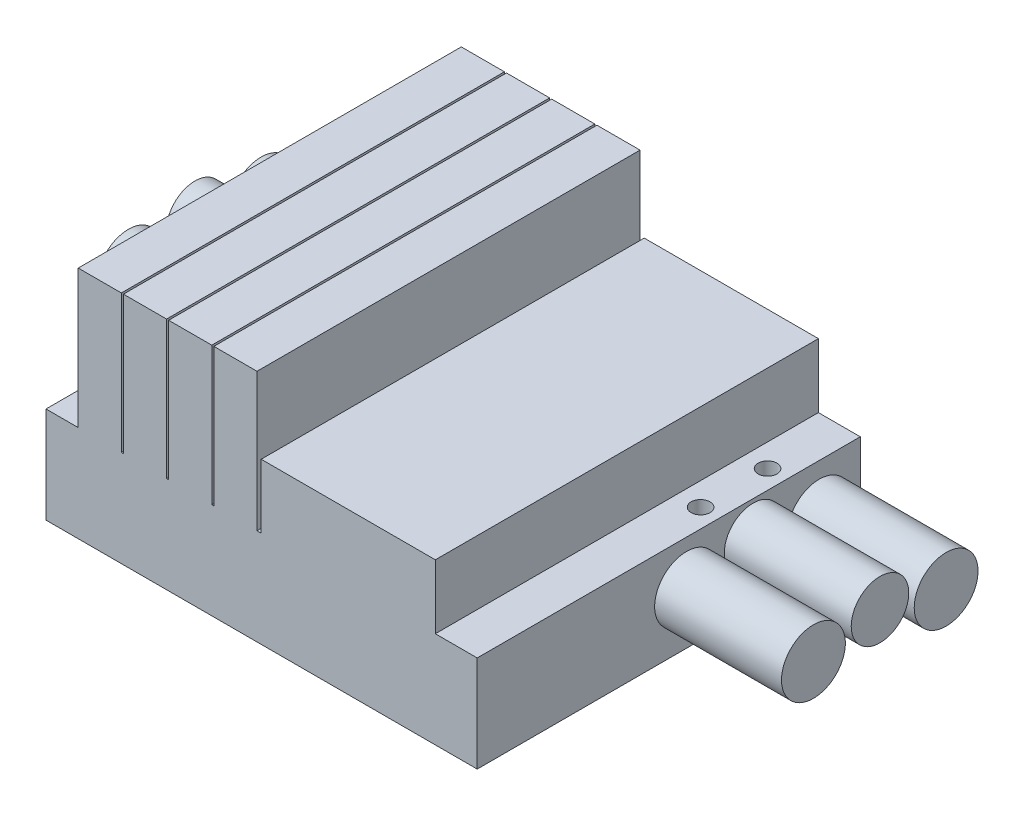
from build123d import *

# Parameters (mm, degrees)
SKETCH1_W           = 103
SKETCH1_H           = 91.5
SKETCH1_R           = 2.15
SKETCH1_R_2         = 2.25
BOSS_EXTRUDE1_DEPTH = 23
SKETCH2_R           = 7.625
SKETCH2_R_2         = 6.875
BOSS_EXTRUDE2_DEPTH = 30.31
SKETCH4_R           = 4.9
BOSS_EXTRUDE3_DEPTH = 14.15
BOSS_EXTRUDE4_START = -133.31
SKETCH2_7_R         = 7.625
SKETCH2_7_R_2       = 6.875
BOSS_EXTRUDE4_DEPTH = 30.31
SKETCH6_W           = 41.6
SKETCH6_H           = 91.5
BOSS_EXTRUDE5_DEPTH = 15.3
SKETCH6_5_W         = 10.3
SKETCH6_5_H         = 91.5
BOSS_EXTRUDE7_DEPTH = 33


with BuildPart() as part:
    # Sketch1 → Boss-Extrude1 (new body)
    with BuildSketch(Plane(origin=(0, 0, 0), x_dir=(1, 0, 0), z_dir=(0, 1, 0))):
        Rectangle(SKETCH1_W, SKETCH1_H)
        with Locations(Location((-47, 28.1, 0), (0, 0, 270))):
            Circle(SKETCH1_R, mode=Mode.SUBTRACT)
        with Locations(Location((-47, 12.1, 0), (0, 0, 270))):
            Circle(SKETCH1_R, mode=Mode.SUBTRACT)
        with Locations(Location((47, 28.1, 0), (0, 0, 270))):
            Circle(SKETCH1_R_2, mode=Mode.SUBTRACT)
        with Locations(Location((47, 12.1, 0), (0, 0, 270))):
            Circle(SKETCH1_R_2, mode=Mode.SUBTRACT)
    extrude(amount=BOSS_EXTRUDE1_DEPTH)

    # Sketch2 → Boss-Extrude2 (add)
    with BuildSketch(Plane.ZY.offset(51.5)):
        with Locations((-35.95, 11.5)):
            Circle(SKETCH2_R)
        with Locations((-20.15, 15.2)):
            Circle(SKETCH2_R_2)
        with Locations((-4.25, 12.4)):
            Circle(SKETCH2_R)
    extrude(amount=BOSS_EXTRUDE2_DEPTH)

    # Sketch4 → Boss-Extrude3 (add)
    with BuildSketch(Plane(origin=(0, 0, -45.75), x_dir=(-1, 0, 0), z_dir=(0, 0, -1))):
        with Locations((5.8, 5.4)):
            Circle(SKETCH4_R)
        with Locations((0.8, 17.6)):
            Circle(SKETCH4_R)
        with Locations((11.3, 17.6)):
            Circle(SKETCH4_R)
        with Locations((16.3, 5.4)):
            Circle(SKETCH4_R)
        with Locations((21.8, 17.6)):
            Circle(SKETCH4_R)
        with Locations((26.8, 5.4)):
            Circle(SKETCH4_R)
        with Locations((32.3, 17.6)):
            Circle(SKETCH4_R)
        with Locations((37.3, 5.4)):
            Circle(SKETCH4_R)
    extrude(amount=BOSS_EXTRUDE3_DEPTH)

    # Sketch2<7> → Boss-Extrude4 (add)
    with BuildSketch(Plane.ZY.offset(51.5).offset(BOSS_EXTRUDE4_START)):
        with Locations((-35.95, 11.5)):
            Circle(SKETCH2_7_R)
        with Locations((-20.15, 15.2)):
            Circle(SKETCH2_7_R_2)
        with Locations((-4.25, 12.4)):
            Circle(SKETCH2_7_R)
    extrude(amount=BOSS_EXTRUDE4_DEPTH)

    # Sketch6 → Boss-Extrude5 (add)
    with BuildSketch(Plane(origin=(0, 23, 0), x_dir=(1, 0, 0), z_dir=(0, 1, 0))):
        with Locations((20.7, 0)):
            Rectangle(SKETCH6_W, SKETCH6_H)
    extrude(amount=BOSS_EXTRUDE5_DEPTH)

    # Sketch6<5> → Boss-Extrude7 (add)
    with BuildSketch(Plane(origin=(0, 23, 0), x_dir=(1, 0, 0), z_dir=(0, 1, 0))):
        with Locations((-17.05, 0)):
            Rectangle(SKETCH6_5_W, SKETCH6_5_H)
        with Locations((-6.25, 0)):
            Rectangle(SKETCH6_5_W, SKETCH6_5_H)
        with Locations((-27.85, 0)):
            Rectangle(SKETCH6_5_W, SKETCH6_5_H)
        with Locations((-38.65, 0)):
            Rectangle(SKETCH6_5_W, SKETCH6_5_H)
    extrude(amount=BOSS_EXTRUDE7_DEPTH)


solid = part.part
